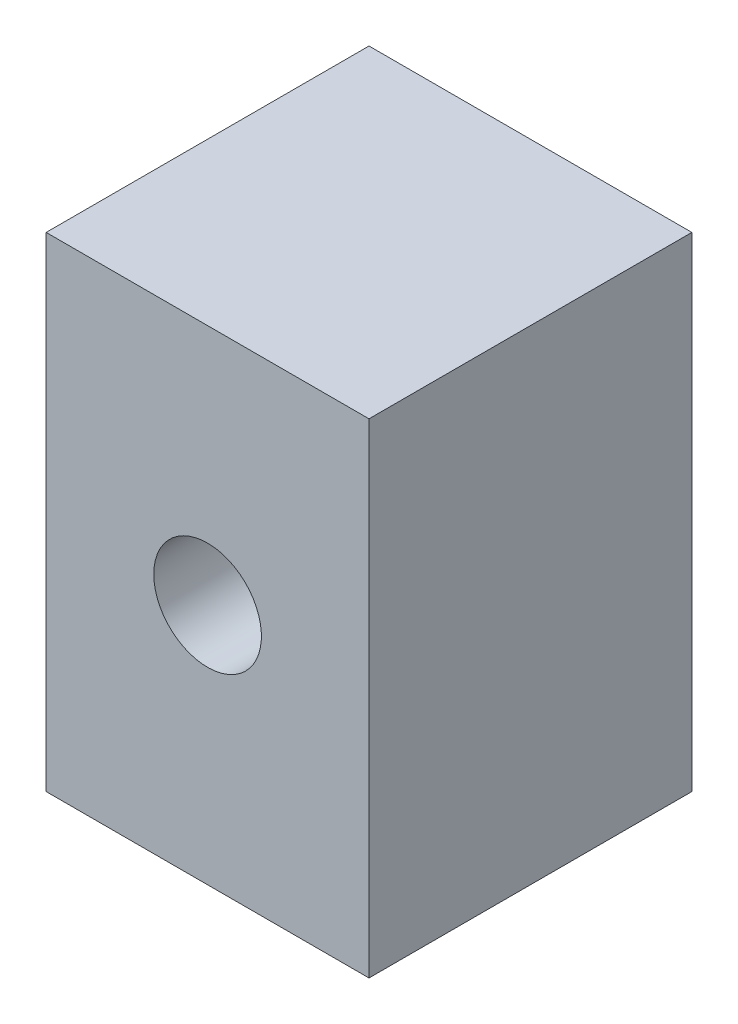
from build123d import *

# Parameters (mm, degrees)
SKETCH1_W           = 76.2
SKETCH1_H           = 114.3
SKETCH1_R           = 12.7
BOSS_EXTRUDE1_DEPTH = 38.1


with BuildPart() as part:
    # Sketch1 → Boss-Extrude1 (new, symmetric)
    with BuildSketch(Plane.XY):
        Rectangle(SKETCH1_W, SKETCH1_H)
        with Locations(Location((0, 0, 0), (0, 0, 180))):
            Circle(SKETCH1_R, mode=Mode.SUBTRACT)
    extrude(amount=BOSS_EXTRUDE1_DEPTH, both=True)


solid = part.part
